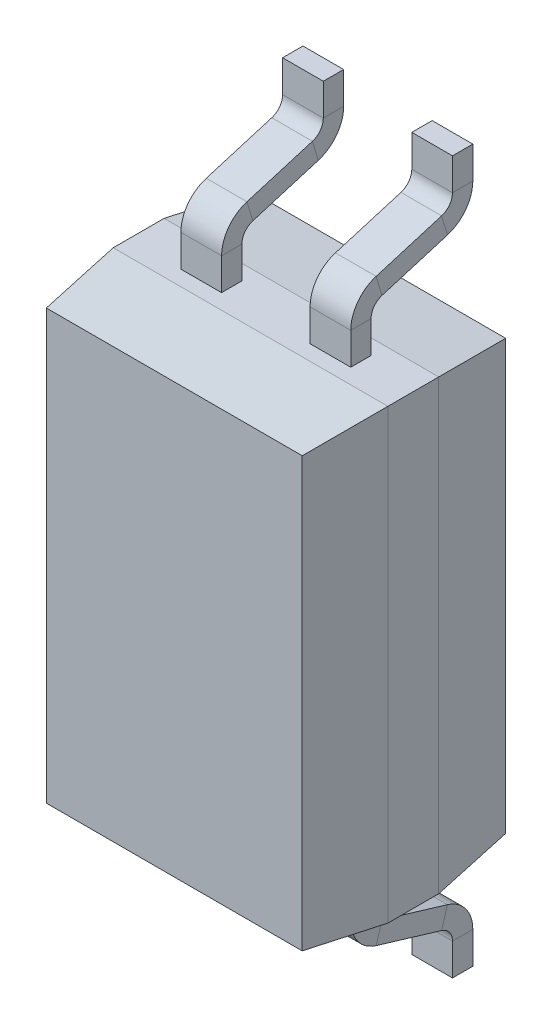
from build123d import *
from OCP.BRepFilletAPI import BRepFilletAPI_MakeChamfer

# Parameters (mm, degrees)
SKETCH_1_W               = 2.7
SKETCH_1_H               = 4.4
EXTRUDE_1_DEPTH          = 2
CHAMFER_1_SIZE           = 0.75
CHAMFER_1_SIZE2          = 0.092088421
SKETCH_2_W               = 0.4
SKETCH_2_H               = 0.2
PATTERN_LINEAR_1_COUNT   = 2
PATTERN_LINEAR_1_PITCH   = 1.27
MIRROR_1_COPY_1_SKETCH_W = 0.4
MIRROR_1_COPY_1_SKETCH_H = 0.2


with BuildPart() as part:
    # 草图1 → 凸台-拉伸1 (new body)
    with BuildSketch(Plane.XY):
        Rectangle(SKETCH_1_W, SKETCH_1_H)
    extrude(amount=EXTRUDE_1_DEPTH)

    # 倒角1: one chamfer whose edges measure the first distance from different faces: ONE call of the kernel's chamfer builder (chamfer() names one face for all edges)
    chamfer_1_edges_1 = [part.edges().sort_by_distance(p)[0] for p in [
        (-1.35, 0, 2),
        (-1.35, 0, 0),
    ]]
    chamfer_1_side_1 = [part.faces().sort_by_distance(p)[0] for p in [
        (-1.35, 0, 1),
    ]]
    chamfer_1_edges_2 = [part.edges().sort_by_distance(p)[0] for p in [
        (0, -2.2, 2),
        (0, -2.2, 0),
    ]]
    chamfer_1_side_2 = [part.faces().sort_by_distance(p)[0] for p in [
        (0, -2.2, 1),
    ]]
    chamfer_1_edges_3 = [part.edges().sort_by_distance(p)[0] for p in [
        (1.35, 0, 2),
        (1.35, 0, 0),
    ]]
    chamfer_1_side_3 = [part.faces().sort_by_distance(p)[0] for p in [
        (1.35, 0, 1),
    ]]
    chamfer_1_edges_4 = [part.edges().sort_by_distance(p)[0] for p in [
        (0, 2.2, 0),
        (0, 2.2, 2),
    ]]
    chamfer_1_side_4 = [part.faces().sort_by_distance(p)[0] for p in [
        (0, 2.2, 1),
    ]]
    chamfer_1 = BRepFilletAPI_MakeChamfer(part.part.solid().wrapped)
    for e in chamfer_1_edges_1:
        chamfer_1.Add(CHAMFER_1_SIZE, CHAMFER_1_SIZE2, e.wrapped, chamfer_1_side_1[0].wrapped)  # the first distance lies on this face
    for e in chamfer_1_edges_2:
        chamfer_1.Add(CHAMFER_1_SIZE, CHAMFER_1_SIZE2, e.wrapped, chamfer_1_side_2[0].wrapped)  # the first distance lies on this face
    for e in chamfer_1_edges_3:
        chamfer_1.Add(CHAMFER_1_SIZE, CHAMFER_1_SIZE2, e.wrapped, chamfer_1_side_3[0].wrapped)  # the first distance lies on this face
    for e in chamfer_1_edges_4:
        chamfer_1.Add(CHAMFER_1_SIZE, CHAMFER_1_SIZE2, e.wrapped, chamfer_1_side_4[0].wrapped)  # the first distance lies on this face
    add(Compound.cast(chamfer_1.Shape()), mode=Mode.REPLACE)

    # 扫描1: sweep along a path in 草图3
    with BuildLine(Plane(origin=(0, 0, 0), x_dir=(0, 0, -1), z_dir=(1, 0, 0))) as sweep_1_path:
        Line((0, -3.5), (0, -3.186007663))
        ThreePointArc((0, -3.186007663), (-0.049426768, -3.03677503), (-0.178163029, -2.946551091))
        Line((-0.178163029, -2.946551091), (-0.821836971, -2.753448909))
        ThreePointArc((-0.821836971, -2.753448909), (-0.950573232, -2.66322497), (-1, -2.513992337))
        Line((-1, -2.513992337), (-1, -2.2))
    # 草图2 → 扫描1 (sweep)
    with BuildSketch(Plane.XZ.offset(2.2)):
        with Locations((0.635, 1)):
            Rectangle(SKETCH_2_W, SKETCH_2_H)
    sweep_1 = sweep(path=sweep_1_path.line)

    # 阵列(线性)1: 扫描1 ×2
    with Locations(*[(-i * PATTERN_LINEAR_1_PITCH, 0, 0) for i in range(1, PATTERN_LINEAR_1_COUNT)]):
        add(sweep_1)

    # 镜向1: 扫描1 across plane
    add(sweep_1.mirror(Plane.ZX))

    # 镜向1 copy 1: sweep along a path in 镜向1 copy 1 path
    with BuildLine(Plane(origin=(-1.27, 0, 0), x_dir=(0, 0, -1), z_dir=(1, 0, 0))) as mirror_1_copy_1_path:
        Line((0, 3.5), (0, 3.186007663))
        ThreePointArc((0, 3.186007663), (-0.049426768, 3.03677503), (-0.178163029, 2.946551091))
        Line((-0.178163029, 2.946551091), (-0.821836971, 2.753448909))
        ThreePointArc((-0.821836971, 2.753448909), (-0.950573232, 2.66322497), (-1, 2.513992337))
        Line((-1, 2.513992337), (-1, 2.2))
    # 镜向1 copy 1 sketch → 镜向1 copy 1 (sweep)
    with BuildSketch(Plane(origin=(-1.27, 2.2, 0), x_dir=(1, 0, 0), z_dir=(0, 1, 0))):
        with Locations((0.635, -1)):
            Rectangle(MIRROR_1_COPY_1_SKETCH_W, MIRROR_1_COPY_1_SKETCH_H)
    sweep(path=mirror_1_copy_1_path.line)


solid = part.part
